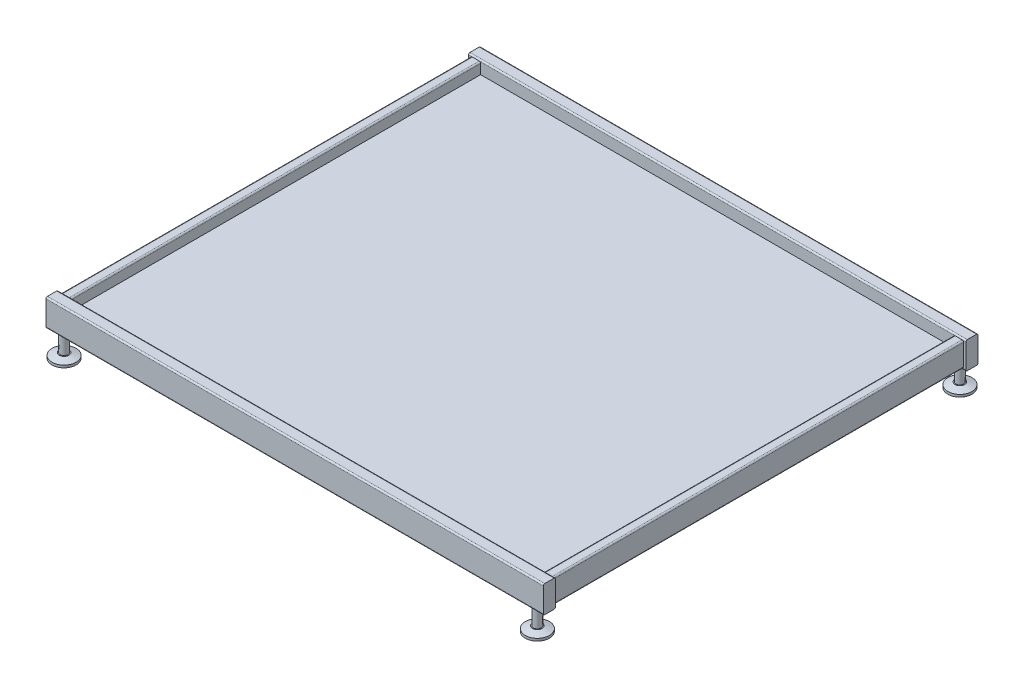
from build123d import *

# Parameters (mm, degrees)
EXTRUDE_1_DEPTH      = 425
EXTRUDE_1_2_DEPTH    = 425
EXTRUDE_4_DEPTH      = 515
EXTRUDE_4_DEPTH_BACK = 515
SKETCH_3_W           = 980
SKETCH_3_H           = 850
EXTRUDE_5_DEPTH      = 2


with BuildPart() as part:
    # Эскиз1 → Бобышка-Вытянуть1 (new, symmetric)
    with BuildSketch(Plane.XY):
        with BuildLine():
            Line((-507, 25), (-493, 25))
            ThreePointArc((-493, 25), (-490.878679656, 24.121320344), (-490, 22))
            Line((-490, 22), (-490, -22))
            ThreePointArc((-490, -22), (-490.878679656, -24.121320344), (-493, -25))
            Line((-493, -25), (-507, -25))
            ThreePointArc((-507, -25), (-509.121320344, -24.121320344), (-510, -22))
            Line((-510, -22), (-510, 22))
            ThreePointArc((-510, 22), (-509.121320344, 24.121320344), (-507, 25))
        make_face()
        with BuildLine():
            Line((-508.5, 22), (-508.5, -22))
            ThreePointArc((-508.5, -22), (-508.060660172, -23.060660172), (-507, -23.5))
            Line((-507, -23.5), (-493, -23.5))
            ThreePointArc((-493, -23.5), (-491.939339828, -23.060660172), (-491.5, -22))
            Line((-491.5, -22), (-491.5, 22))
            ThreePointArc((-491.5, 22), (-491.939339828, 23.060660172), (-493, 23.5))
            Line((-493, 23.5), (-507, 23.5))
            ThreePointArc((-507, 23.5), (-508.060660172, 23.060660172), (-508.5, 22))
        make_face(mode=Mode.SUBTRACT)
    extrude(amount=EXTRUDE_1_DEPTH, both=True)



with BuildPart() as body_2:
    # Эскиз1 → Extrude 1 2 (new, symmetric)
    with BuildSketch(Plane.XY):
        with BuildLine():
            Line((490, 22), (490, -22))
            ThreePointArc((490, -22), (490.878679656, -24.121320344), (493, -25))
            Line((493, -25), (507, -25))
            ThreePointArc((507, -25), (509.121320344, -24.121320344), (510, -22))
            Line((510, -22), (510, 22))
            ThreePointArc((510, 22), (509.121320344, 24.121320344), (507, 25))
            Line((507, 25), (493, 25))
            ThreePointArc((493, 25), (490.878679656, 24.121320344), (490, 22))
        make_face()
        with BuildLine():
            Line((507, 23.5), (493, 23.5))
            ThreePointArc((493, 23.5), (491.939339828, 23.060660172), (491.5, 22))
            Line((491.5, 22), (491.5, -22))
            ThreePointArc((491.5, -22), (491.939339828, -23.060660172), (493, -23.5))
            Line((493, -23.5), (507, -23.5))
            ThreePointArc((507, -23.5), (508.060660172, -23.060660172), (508.5, -22))
            Line((508.5, -22), (508.5, 22))
            ThreePointArc((508.5, 22), (508.060660172, 23.060660172), (507, 23.5))
        make_face(mode=Mode.SUBTRACT)
    extrude(amount=EXTRUDE_1_2_DEPTH, both=True)

    # Эскиз2 → Бобышка-Вытянуть4 (add, two sides: drawn at the far end of the back side and taken through both)
    with BuildSketch(Plane(origin=(0, 0, 0), x_dir=(0, 0, -1), z_dir=(1, 0, 0)).offset(-EXTRUDE_4_DEPTH_BACK)):
        with BuildLine():
            Line((425, -25), (425, 25))
            ThreePointArc((425, 25), (425.878679656, 27.121320344), (428, 28))
            Line((428, 28), (447, 28))
            ThreePointArc((447, 28), (449.121320344, 27.121320344), (450, 25))
            Line((450, 25), (450, -25))
            ThreePointArc((450, -25), (449.121320344, -27.121320344), (447, -28))
            Line((447, -28), (428, -28))
            ThreePointArc((428, -28), (425.878679656, -27.121320344), (425, -25))
        make_face()
        with BuildLine():
            Line((-428, -28), (-447, -28))
            ThreePointArc((-447, -28), (-449.121320344, -27.121320344), (-450, -25))
            Line((-450, -25), (-450, 25))
            ThreePointArc((-450, 25), (-449.121320344, 27.121320344), (-447, 28))
            Line((-447, 28), (-428, 28))
            ThreePointArc((-428, 28), (-425.878679656, 27.121320344), (-425, 25))
            Line((-425, 25), (-425, -25))
            ThreePointArc((-425, -25), (-425.878679656, -27.121320344), (-428, -28))
        make_face()
    extrude(amount=EXTRUDE_4_DEPTH + EXTRUDE_4_DEPTH_BACK)


with BuildPart() as part_1:
    add(part.part)

    add(body_2.part)  # Бобышка-Вытянуть5 merges body 2
    # Эскиз3 → Бобышка-Вытянуть5 (add)
    with BuildSketch(Plane(origin=(0, 0, 0), x_dir=(1, 0, 0), z_dir=(0, 1, 0))):
        Rectangle(SKETCH_3_W, SKETCH_3_H)
    extrude(amount=EXTRUDE_5_DEPTH)

    # Эскиз4 → Повернуть1 (revolve)
    with BuildSketch(Plane(origin=(-490, 0, 0), x_dir=(0, 0, -1), z_dir=(1, 0, 0)), mode=Mode.PRIVATE) as revolve_1_sk:
        Polygon((-437.5, -28), (-429.5, -28), (-429.5, -65), (-427.5, -65), (-412.5, -70), (-412.5, -75), (-437.5, -75), align=None)
    revolve_1 = revolve(revolve_1_sk.sketch.rotate(Axis((-490, 28, 437.5), (0, -1, 0)), 180), axis=Axis((-490, 28, 437.5), (0, -1, 0)))

    # Зеркальное отражение1: Повернуть1 across plane
    add(revolve_1.mirror(Plane(origin=(0, 0, 0), x_dir=(0, 0, 1), z_dir=(1, 0, 0))))

    # Зеркальное отражение2: Повернуть1 across plane
    add(revolve_1.mirror(Plane.XY))

    # Зеркальное отражение2 copy 1 sketch → Зеркальное отражение2 copy 1 (revolve)
    with BuildSketch(Plane.ZY.offset(-490)):
        Polygon((-437.5, -28), (-429.5, -28), (-429.5, -65), (-427.5, -65), (-412.5, -70), (-412.5, -75), (-437.5, -75), align=None)
    revolve(axis=Axis((490, 28, -437.5), (0, -1, 0)))


solid = part_1.part
